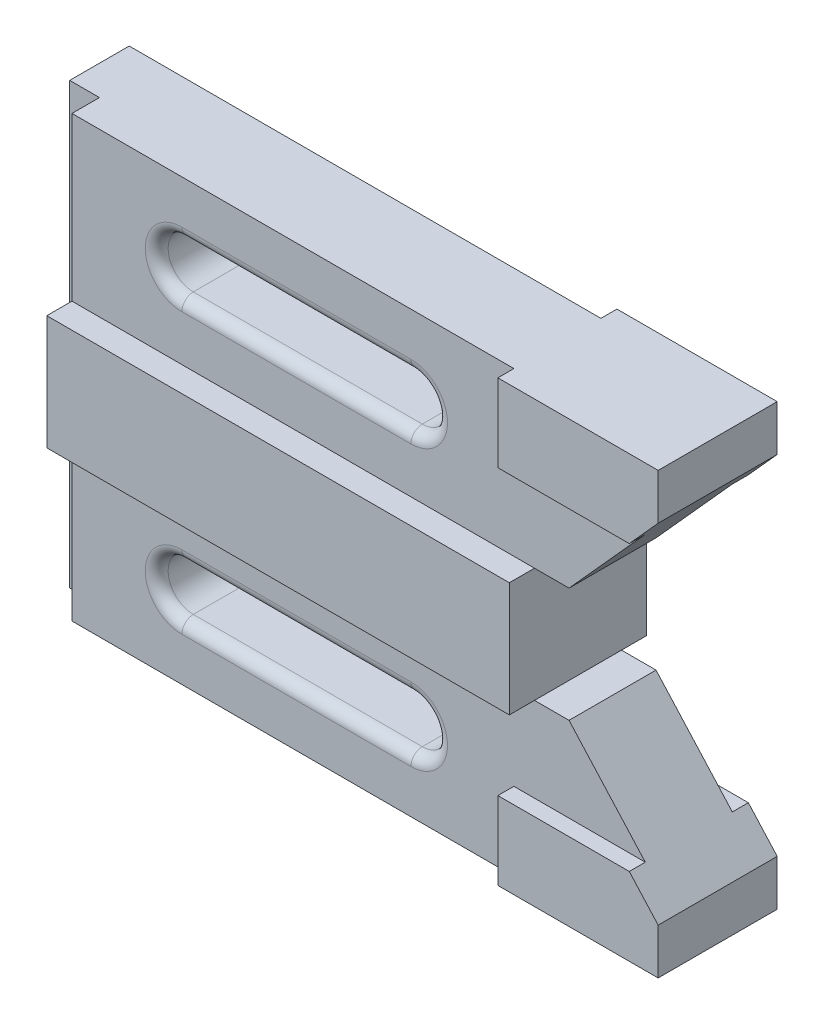
from build123d import *

# Parameters (mm, degrees)
BOSS_EXTRUDE1_DEPTH = 9.5
SKETCH5_W           = 107.5
SKETCH5_H           = 25
BOSS_EXTRUDE4_DEPTH = 15
BOSS_EXTRUDE5_DEPTH = 13
SKETCH7_W           = 6.5
SKETCH7_H           = 11.5
CUT_EXTRUDE1_DEPTH  = 169.774998148
FILLET1_R           = 2.5


with BuildPart() as part:
    # Sketch1 → Boss-Extrude1 (new, symmetric)
    with BuildSketch(Plane.XY):
        Polygon((0, 0), (-138, 0), (-138, 96), (0, 96), (0, 86), (-22.96030313, 60.5), (-30.5, 60.5), (-30.5, 35.5), (-22.96030313, 35.5), (0, 10), align=None)
        with BuildLine():
            Line((-107.5, 84), (-57.5, 84))
            ThreePointArc((-57.5, 84), (-52, 78.5), (-57.5, 73))
            Line((-57.5, 73), (-107.5, 73))
            ThreePointArc((-107.5, 73), (-113, 78.5), (-107.5, 84))
        make_face(mode=Mode.SUBTRACT)
        with BuildLine():
            Line((-107.5, 23), (-57.5, 23))
            ThreePointArc((-57.5, 23), (-52, 17.5), (-57.5, 12))
            Line((-57.5, 12), (-107.5, 12))
            ThreePointArc((-107.5, 12), (-113, 17.5), (-107.5, 23))
        make_face(mode=Mode.SUBTRACT)
    extrude(amount=BOSS_EXTRUDE1_DEPTH, both=True)

    # Sketch5 → Boss-Extrude4 (add, symmetric)
    with BuildSketch(Plane.XY):
        with Locations((-84.25, 48)):
            Rectangle(SKETCH5_W, SKETCH5_H)
    extrude(amount=BOSS_EXTRUDE4_DEPTH, both=True)

    # Sketch6 → Boss-Extrude5 (add, symmetric)
    with BuildSketch(Plane.XY):
        Polygon((-6.30282831, 79), (-35, 79), (-35, 96), (0, 96), (0, 86), align=None)
        Polygon((-6.30282831, 17), (-35, 17), (-35, 0), (0, 0), (0, 10), align=None)
    extrude(amount=BOSS_EXTRUDE5_DEPTH, both=True)

    # Sketch7 → Cut-Extrude1 (cut, through all)
    with BuildSketch(Plane(origin=(0, 96, 0), x_dir=(1, 0, 0), z_dir=(0, 1, 0))):
        with Locations((-134.75, -9.25)):
            Rectangle(SKETCH7_W, SKETCH7_H)
    extrude(amount=-CUT_EXTRUDE1_DEPTH, mode=Mode.SUBTRACT)

    # Fillet1
    fillet1_edges = [part.edges().sort_by_distance(p)[0] for p in [
        (-113, 78.5, -9.5),
        (-82.5, 73, -9.5),
        (-52, 78.5, -9.5),
        (-82.5, 84, -9.5),
        (-113, 78.5, 9.5),
        (-82.5, 73, 9.5),
        (-52, 78.5, 9.5),
        (-82.5, 84, 9.5),
        (-113, 17.5, -9.5),
        (-82.5, 12, -9.5),
        (-52, 17.5, -9.5),
        (-82.5, 23, -9.5),
        (-113, 17.5, 9.5),
        (-82.5, 12, 9.5),
        (-52, 17.5, 9.5),
        (-82.5, 23, 9.5),
    ]]
    fillet(fillet1_edges, radius=FILLET1_R)


solid = part.part
